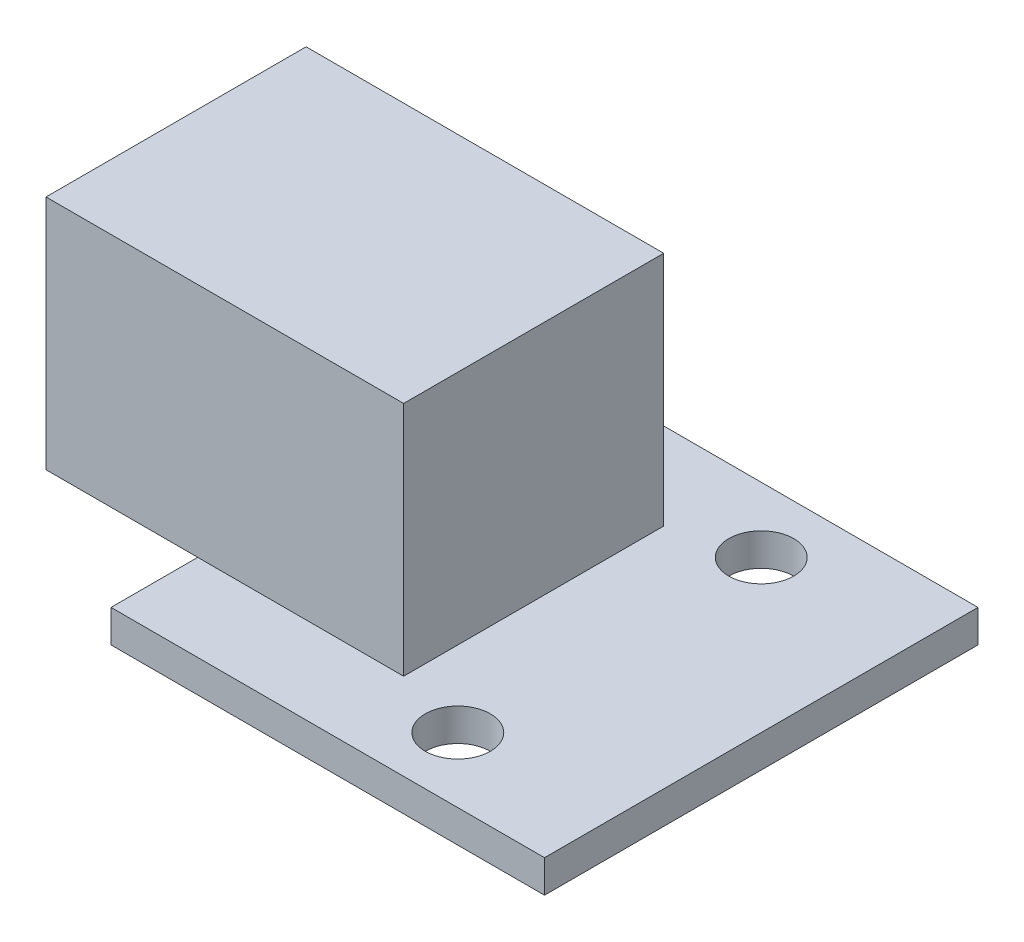
from build123d import *

# Parameters (mm, degrees)
SKETCH1_W           = 20
SKETCH1_H           = 20
SKETCH1_R           = 1.5
BOSS_EXTRUDE1_DEPTH = 1.5
SKETCH2_W           = 16.5
SKETCH2_H           = 12
BOSS_EXTRUDE2_DEPTH = 10.9


with BuildPart() as part:
    # Sketch1 → Boss-Extrude1 (new body)
    with BuildSketch(Plane(origin=(0, 0, 0), x_dir=(1, 0, 0), z_dir=(0, 1, 0))):
        Rectangle(SKETCH1_W, SKETCH1_H)
        with Locations(Location((3, 7, 0), (0, 0, 270))):
            Circle(SKETCH1_R, mode=Mode.SUBTRACT)
        with Locations(Location((3, -7, 0), (0, 0, 270))):
            Circle(SKETCH1_R, mode=Mode.SUBTRACT)
    extrude(amount=BOSS_EXTRUDE1_DEPTH)

    # Sketch2 → Boss-Extrude2 (add)
    with BuildSketch(Plane(origin=(0, 1.5, 0), x_dir=(1, 0, 0), z_dir=(0, 1, 0))):
        with Locations((-8.75, 0)):
            Rectangle(SKETCH2_W, SKETCH2_H)
    extrude(amount=BOSS_EXTRUDE2_DEPTH)


solid = part.part
